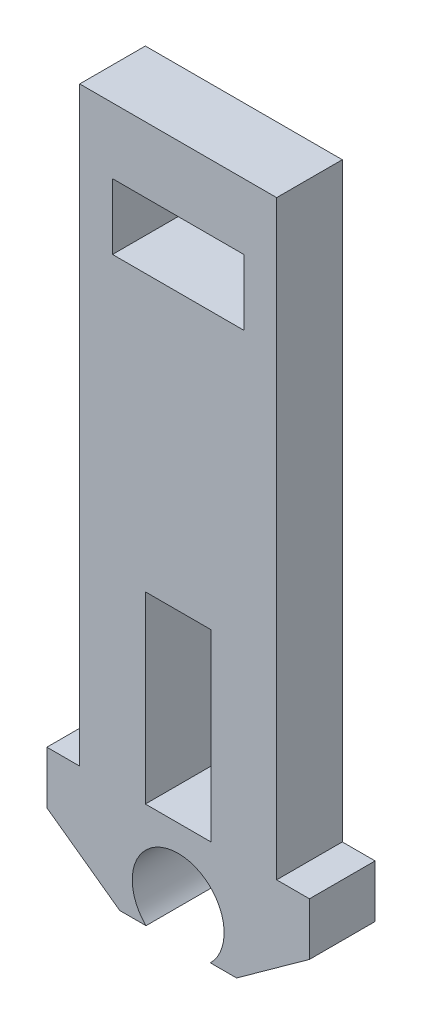
from build123d import *

# Parameters (mm, degrees)
SKETCH1_W           = 5
SKETCH1_H           = 14
SKETCH1_W_2         = 10
SKETCH1_H_2         = 5
BOSS_EXTRUDE1_DEPTH = 5


with BuildPart() as part:
    # Sketch1 → Boss-Extrude1 (new body)
    with BuildSketch(Plane.XY):
        with BuildLine():
            Line((16.949489743, 8), (19.449489743, 8))
            Line((19.449489743, 8), (19.449489743, 4))
            Line((19.449489743, 4), (13.898979486, 0))
            Line((13.898979486, 0), (11.898979486, 0))
            ThreePointArc((11.898979486, 0), (9.449489743, 6), (7, 0))
            Line((7, 0), (5, 0))
            Line((5, 0), (-0.550510257, 4))
            Line((-0.550510257, 4), (-0.550510257, 8))
            Line((-0.550510257, 8), (1.949489743, 8))
            Line((1.949489743, 8), (1.949489743, 53))
            Line((1.949489743, 53), (16.949489743, 53))
            Line((16.949489743, 53), (16.949489743, 8))
        make_face()
        with Locations((9.449489743, 15)):
            Rectangle(SKETCH1_W, SKETCH1_H, mode=Mode.SUBTRACT)
        with Locations((9.449489743, 45.5)):
            Rectangle(SKETCH1_W_2, SKETCH1_H_2, mode=Mode.SUBTRACT)
    extrude(amount=BOSS_EXTRUDE1_DEPTH)


solid = part.part
